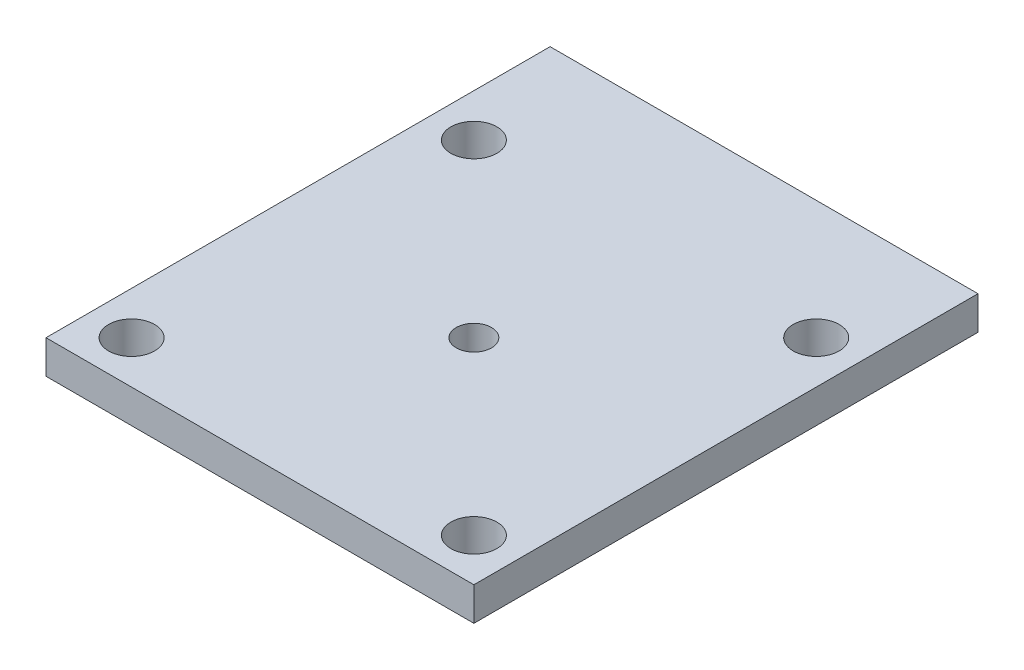
from build123d import *

# Parameters (mm, degrees)
SKETCH1_W             = 40
SKETCH1_H             = 47.125
BOSS_EXTRUDE1_DEPTH   = 3.125
M4_CLEARANCE_HOLE1_D  = 4.3
M4X0_7_TAPPED_HOLE1_D = 3.3


with BuildPart() as part:
    # Sketch1 → Boss-Extrude1 (new body)
    with BuildSketch(Plane(origin=(0, 0, 0), x_dir=(1, 0, 0), z_dir=(0, 1, 0))):
        Rectangle(SKETCH1_W, SKETCH1_H)
    extrude(amount=BOSS_EXTRUDE1_DEPTH)

    # M4 Clearance Hole1 (through all)
    with Locations(Plane(origin=(0, 3.125, 0), x_dir=(1, 0, 0), z_dir=(0, 1, 0))):
        with Locations((16, -19.5625), (-16, -19.5625), (-16, 12.4375), (16, 12.4375)):
            Hole(M4_CLEARANCE_HOLE1_D / 2)

    # M4x0.7 Tapped Hole1 (through all)
    with Locations(Plane(origin=(0, 3.125, 0), x_dir=(1, 0, 0), z_dir=(0, 1, 0))):
        with Locations((0, -3.5625)):
            Hole(M4X0_7_TAPPED_HOLE1_D / 2)


solid = part.part
